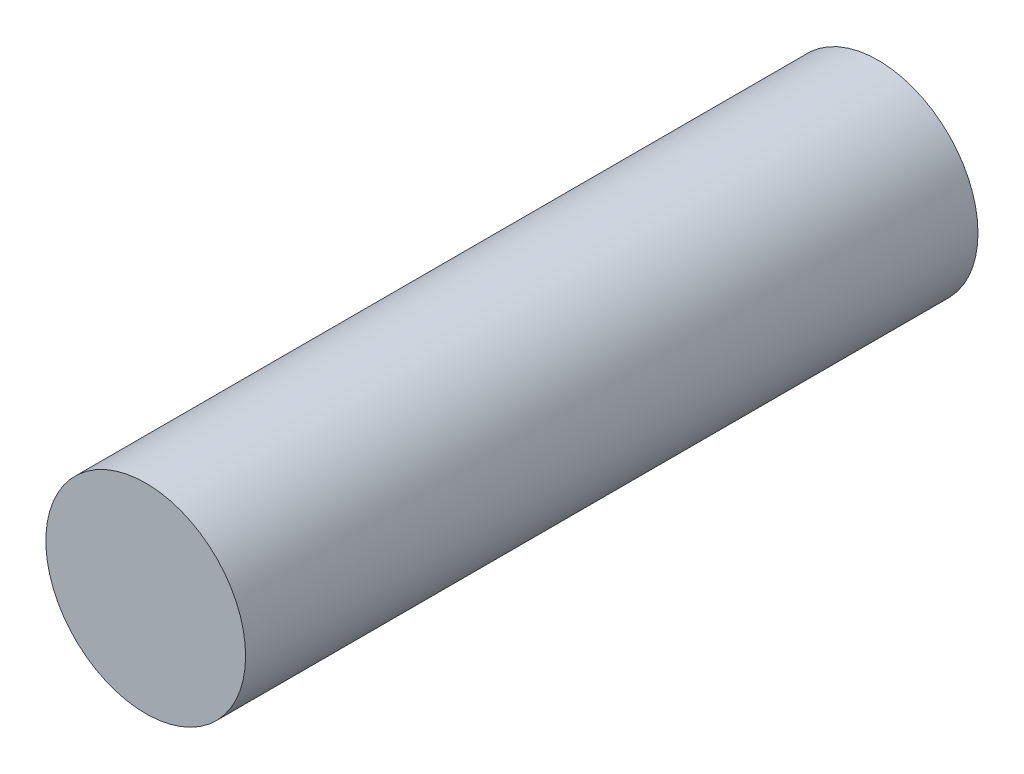
from build123d import *

# Parameters (mm, degrees)
SZKIC1_R                    = 1.5
DODANIE_WYCI_GNI_CIE1_DEPTH = 11


with BuildPart() as part:
    # Szkic1 → Dodanie-wyciągnięcie1 (new body)
    with BuildSketch(Plane.XY):
        Circle(SZKIC1_R)
    extrude(amount=DODANIE_WYCI_GNI_CIE1_DEPTH)


solid = part.part
